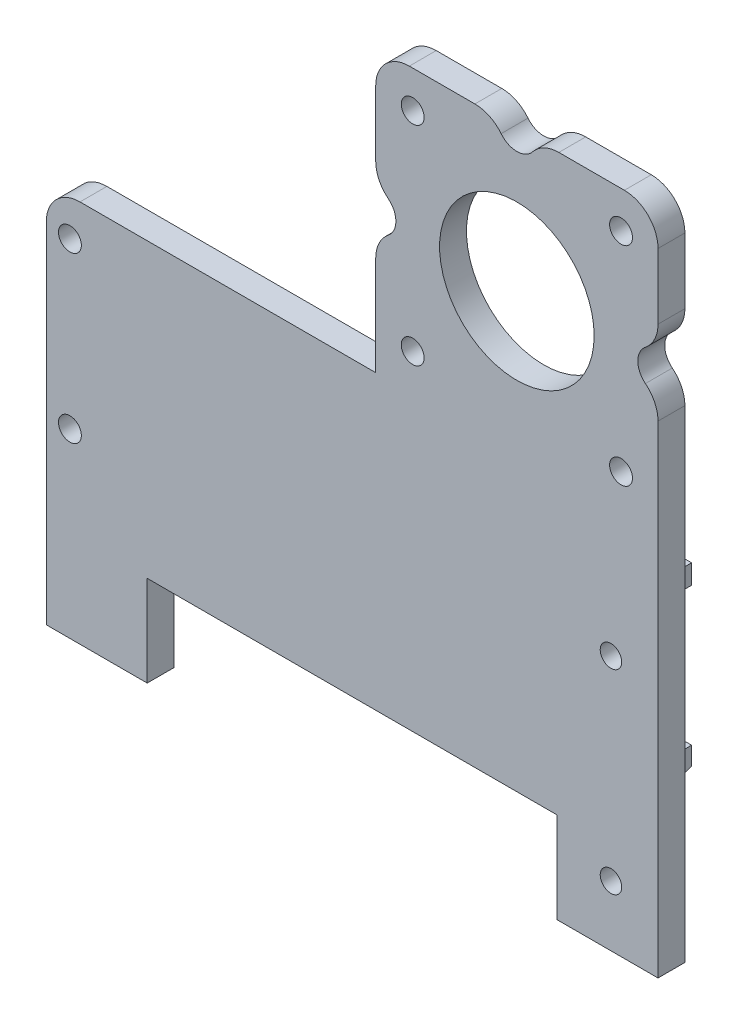
from build123d import *
from OCP.BRepFilletAPI import BRepFilletAPI_MakeChamfer

# Parameters (mm, degrees)
SKETCH_1_R          = 1.7
SKETCH_1_R_2        = 1.6
SKETCH_1_R_3        = 11.5
EXTRUDE_1_DEPTH     = 4
SKETCH_1_4_W        = 80
SKETCH_1_4_H        = 3
EXTRUDE_2_DEPTH     = 12
EXTRUDE_3_DEPTH     = 5
RIB_2_REACH         = 110.296
SKETCH_4_WALL_W     = 240.952461706
SKETCH_4_WALL_H     = 4
CUT_EXTRUDE_5_REACH = 103.686
SKETCH_5_W          = 6.95
SKETCH_5_H          = 0.1
CHAMFER_3_SIZE      = 0.8
CHAMFER_3_SIZE2     = 0.291176187
SKETCH_6_W          = 91
SKETCH_6_H          = 17
EXTRUDE_4_DEPTH     = 4
SKETCH_7_W          = 80
SKETCH_7_H          = 3.5
EXTRUDE_5_DEPTH     = 12
SKETCH_8_R          = 1.6
SKETCH_8_W          = 61
SKETCH_8_H          = 13.5
CUT_EXTRUDE_3_DEPTH = 102.133575038
CUT_EXTRUDE_4_DEPTH = 12
CHAMFER_2_SIZE      = 0.8
CHAMFER_2_SIZE2     = 0.291176187
SKETCH_10_R         = 2.2
CUT_EXTRUDE_6_DEPTH = 112.149673864
FILLET_1_R          = 5


with BuildPart() as part:
    # 草图1 → 凸台-拉伸1 (new body)
    with BuildSketch(Plane.XY):
        with BuildLine():
            Line((-70, -10), (21, -10))
            Line((21, -10), (21, 44.755002002))
            ThreePointArc((21, 44.755002002), (20.506939094, 46.920065511), (19.125, 48.658125751))
            ThreePointArc((19.125, 48.658125751), (18, 51), (19.125, 53.341874249))
            ThreePointArc((19.125, 53.341874249), (20.506939094, 55.079934489), (21, 57.244997998))
            Line((21, 57.244997998), (21, 67))
            ThreePointArc((21, 67), (19.535533906, 70.535533906), (16, 72))
            Line((16, 72), (6.244997998, 72))
            ThreePointArc((6.244997998, 72), (4.079934489, 71.506939094), (2.341874249, 70.125))
            ThreePointArc((2.341874249, 70.125), (0, 69), (-2.341874249, 70.125))
            ThreePointArc((-2.341874249, 70.125), (-4.079934489, 71.506939094), (-6.244997998, 72))
            Line((-6.244997998, 72), (-16, 72))
            ThreePointArc((-16, 72), (-19.535533906, 70.535533906), (-21, 67))
            Line((-21, 67), (-21, 57.244997998))
            ThreePointArc((-21, 57.244997998), (-20.506939094, 55.079934489), (-19.125, 53.341874249))
            ThreePointArc((-19.125, 53.341874249), (-18, 51), (-19.125, 48.658125751))
            ThreePointArc((-19.125, 48.658125751), (-20.506939094, 46.920065511), (-21, 44.755002002))
            Line((-21, 44.755002002), (-21, 30))
            Line((-21, 30), (-70, 30))
            Line((-70, 30), (-70, -10))
        make_face()
        with Locations((-66.5, 0)):
            Circle(SKETCH_1_R, mode=Mode.SUBTRACT)
        with Locations((-66.5, 24.5)):
            Circle(SKETCH_1_R, mode=Mode.SUBTRACT)
        with Locations((14, 11)):
            Circle(SKETCH_1_R_2, mode=Mode.SUBTRACT)
        with Locations((-15.5, 35.5)):
            Circle(SKETCH_1_R, mode=Mode.SUBTRACT)
        with Locations((15.5, 35.5)):
            Circle(SKETCH_1_R, mode=Mode.SUBTRACT)
        with Locations((-15.5, 66.5)):
            Circle(SKETCH_1_R, mode=Mode.SUBTRACT)
        with Locations((0, 51)):
            Circle(SKETCH_1_R_3, mode=Mode.SUBTRACT)
        with Locations((15.5, 66.5)):
            Circle(SKETCH_1_R, mode=Mode.SUBTRACT)
    extrude(amount=EXTRUDE_1_DEPTH)

    # 草图1<4> → 凸台-拉伸2 (add)
    with BuildSketch(Plane.XY):
        with Locations((-30, 11.5)):
            Rectangle(SKETCH_1_4_W, SKETCH_1_4_H)
    extrude(amount=-EXTRUDE_2_DEPTH)

    # 草图1<5> → 凸台-拉伸3 (add)
    with BuildSketch(Plane.XY):
        Polygon((3.05, 8), (3.05, 10), (-3.05, 10), (-3.05, 8), (-5.05, 8), (-5.05, 6.5), (-4.55, 6), (4.55, 6), (5.05, 6.5), (5.05, 8), align=None)
        Polygon((-16.95, 10), (-23.05, 10), (-23.05, 8), (-25.05, 8), (-25.05, 6.5), (-24.55, 6), (-15.45, 6), (-14.95, 6.5), (-14.95, 8), (-16.95, 8), align=None)
        Polygon((-36.95, 10), (-43.05, 10), (-43.05, 8), (-45.05, 8), (-45.05, 6.5), (-44.55, 6), (-35.45, 6), (-34.95, 6.5), (-34.95, 8), (-36.95, 8), align=None)
        Polygon((-26, 4.55), (-26, -4.55), (-26.5, -5.05), (-28, -5.05), (-28, -3.05), (-32, -3.05), (-32, -5.05), (-33.5, -5.05), (-34, -4.55), (-34, 4.55), (-33.5, 5.05), (-32, 5.05), (-32, 3.05), (-28, 3.05), (-28, 5.05), (-26.5, 5.05), align=None)
        Polygon((-23.05, -8), (-23.05, -10), (-16.95, -10), (-16.95, -8), (-14.95, -8), (-14.95, -6.5), (-15.45, -6), (-24.55, -6), (-25.05, -6.5), (-25.05, -8), align=None)
        Polygon((-43.05, -8), (-43.05, -10), (-36.95, -10), (-36.95, -8), (-34.95, -8), (-34.95, -6.5), (-35.45, -6), (-44.55, -6), (-45.05, -6.5), (-45.05, -8), align=None)
    extrude(amount=-EXTRUDE_3_DEPTH)

    # 草图4 wall → 筋2 (add, up to next)
    with BuildSketch(Plane(origin=(10, 23, -5), x_dir=(0, 0.894427191, 0.4472135955), z_dir=(0, -0.4472135955, 0.894427191)), mode=Mode.PRIVATE) as rib_2_sk1:
        with Locations((0, 2)):
            Rectangle(SKETCH_4_WALL_W, SKETCH_4_WALL_H)
    rib_2_tool1 = extrude(rib_2_sk1.sketch, amount=RIB_2_REACH, mode=Mode.PRIVATE) - part.part
    rib_2 = rib_2_tool1.solids().sort_by_distance((10, 23, -5))[0]
    add(rib_2)

    # 镜向1: 筋2 across plane
    add(rib_2.mirror(Plane(origin=(0, 0, 0), x_dir=(0, 0, 1), z_dir=(1, 0, 0))))

    # 切除-拉伸5: up to this face of the body (flat: up to its plane)
    cut_extrude_5_end = Plane(part.part.faces().sort_by_distance((-17.713713812, 21.851646417, 0))[0])
    # 草图5 → 切除-拉伸5 (cut, up to the picked face)
    with BuildSketch(Plane(origin=(0, 0, -12), x_dir=(-1, 0, 0), z_dir=(0, 0, -1)), mode=Mode.PRIVATE) as cut_extrude_5_sk1:
        with Locations((-6.525, 10.05)):
            Rectangle(SKETCH_5_W, SKETCH_5_H)
    cut_extrude_5_tool1 = split(extrude(cut_extrude_5_sk1.sketch, amount=-CUT_EXTRUDE_5_REACH, mode=Mode.PRIVATE), bisect_by=cut_extrude_5_end, keep=Keep.BOTH, mode=Mode.PRIVATE)
    # 草图5 → 切除-拉伸5 (cut, up to the picked face)
    with BuildSketch(Plane(origin=(0, 0, -12), x_dir=(-1, 0, 0), z_dir=(0, 0, -1)), mode=Mode.PRIVATE) as cut_extrude_5_sk2:
        Polygon((16.95, 10), (17.2, 10), (17.2, 10.1), (3.05, 10.1), (3.05, 10), align=None)
    cut_extrude_5_tool2 = split(extrude(cut_extrude_5_sk2.sketch, amount=-CUT_EXTRUDE_5_REACH, mode=Mode.PRIVATE), bisect_by=cut_extrude_5_end, keep=Keep.BOTH, mode=Mode.PRIVATE)
    # 草图5 → 切除-拉伸5 (cut, up to the picked face)
    with BuildSketch(Plane(origin=(0, 0, -12), x_dir=(-1, 0, 0), z_dir=(0, 0, -1)), mode=Mode.PRIVATE) as cut_extrude_5_sk3:
        Polygon((17.2, 7.75), (17.2, 10), (16.95, 10), (16.95, 8), (14.95, 8), (14.95, 7.75), align=None)
    cut_extrude_5_tool3 = split(extrude(cut_extrude_5_sk3.sketch, amount=-CUT_EXTRUDE_5_REACH, mode=Mode.PRIVATE), bisect_by=cut_extrude_5_end, keep=Keep.BOTH, mode=Mode.PRIVATE)
    # 草图5 → 切除-拉伸5 (cut, up to the picked face)
    with BuildSketch(Plane(origin=(0, 0, -12), x_dir=(-1, 0, 0), z_dir=(0, 0, -1)), mode=Mode.PRIVATE) as cut_extrude_5_sk4:
        Polygon((23.05, 8), (23.05, 10), (22.8, 10), (22.8, 7.75), (25.05, 7.75), (25.05, 8), align=None)
    cut_extrude_5_tool4 = split(extrude(cut_extrude_5_sk4.sketch, amount=-CUT_EXTRUDE_5_REACH, mode=Mode.PRIVATE), bisect_by=cut_extrude_5_end, keep=Keep.BOTH, mode=Mode.PRIVATE)
    # 草图5 → 切除-拉伸5 (cut, up to the picked face)
    with BuildSketch(Plane(origin=(0, 0, -12), x_dir=(-1, 0, 0), z_dir=(0, 0, -1)), mode=Mode.PRIVATE) as cut_extrude_5_sk5:
        Polygon((22.8, 10), (23.05, 10), (36.95, 10), (37.2, 10), (37.2, 10.1), (22.8, 10.1), align=None)
    cut_extrude_5_tool5 = split(extrude(cut_extrude_5_sk5.sketch, amount=-CUT_EXTRUDE_5_REACH, mode=Mode.PRIVATE), bisect_by=cut_extrude_5_end, keep=Keep.BOTH, mode=Mode.PRIVATE)
    # 草图5 → 切除-拉伸5 (cut, up to the picked face)
    with BuildSketch(Plane(origin=(0, 0, -12), x_dir=(-1, 0, 0), z_dir=(0, 0, -1)), mode=Mode.PRIVATE) as cut_extrude_5_sk6:
        Polygon((42.8, 10.1), (42.8, 10), (43.05, 10), (70, 10), (70, 10.1), align=None)
    cut_extrude_5_tool6 = split(extrude(cut_extrude_5_sk6.sketch, amount=-CUT_EXTRUDE_5_REACH, mode=Mode.PRIVATE), bisect_by=cut_extrude_5_end, keep=Keep.BOTH, mode=Mode.PRIVATE)
    # 草图5 → 切除-拉伸5 (cut, up to the picked face)
    with BuildSketch(Plane(origin=(0, 0, -12), x_dir=(-1, 0, 0), z_dir=(0, 0, -1)), mode=Mode.PRIVATE) as cut_extrude_5_sk7:
        Polygon((43.05, 10), (42.8, 10), (42.8, 7.75), (45.05, 7.75), (45.05, 8), (43.05, 8), align=None)
    cut_extrude_5_tool7 = split(extrude(cut_extrude_5_sk7.sketch, amount=-CUT_EXTRUDE_5_REACH, mode=Mode.PRIVATE), bisect_by=cut_extrude_5_end, keep=Keep.BOTH, mode=Mode.PRIVATE)
    # 草图5 → 切除-拉伸5 (cut, up to the picked face)
    with BuildSketch(Plane(origin=(0, 0, -12), x_dir=(-1, 0, 0), z_dir=(0, 0, -1)), mode=Mode.PRIVATE) as cut_extrude_5_sk8:
        Polygon((37.2, 10), (36.95, 10), (36.95, 8), (34.95, 8), (34.95, 7.75), (37.2, 7.75), align=None)
    cut_extrude_5_tool8 = split(extrude(cut_extrude_5_sk8.sketch, amount=-CUT_EXTRUDE_5_REACH, mode=Mode.PRIVATE), bisect_by=cut_extrude_5_end, keep=Keep.BOTH, mode=Mode.PRIVATE)
    add(cut_extrude_5_tool1.solids().sort_by(Axis((6.525, 10.05, -12), (0, 0, 1)))[0], mode=Mode.SUBTRACT)
    add(cut_extrude_5_tool2.solids().sort_by(Axis((-10.125, 10.05, -12), (0, 0, 1)))[0], mode=Mode.SUBTRACT)
    add(cut_extrude_5_tool3.solids().sort_by(Axis((-17.16818, 8.875, -12), (0, 0, 1)))[0], mode=Mode.SUBTRACT)
    add(cut_extrude_5_tool4.solids().sort_by(Axis((-23.01818, 9, -12), (0, 0, 1)))[0], mode=Mode.SUBTRACT)
    add(cut_extrude_5_tool5.solids().sort_by(Axis((-30, 10.05, -12), (0, 0, 1)))[0], mode=Mode.SUBTRACT)
    add(cut_extrude_5_tool6.solids().sort_by(Axis((-56.4, 10.05, -12), (0, 0, 1)))[0], mode=Mode.SUBTRACT)
    add(cut_extrude_5_tool7.solids().sort_by(Axis((-42.925, 9.96818, -12), (0, 0, 1)))[0], mode=Mode.SUBTRACT)
    add(cut_extrude_5_tool8.solids().sort_by(Axis((-37.075, 9.96818, -12), (0, 0, 1)))[0], mode=Mode.SUBTRACT)

    # 倒角3: one chamfer whose edges measure the first distance from different faces: ONE call of the kernel's chamfer builder (chamfer() names one face for all edges)
    chamfer_3_edges_1 = [part.edges().sort_by_distance(p)[0] for p in [
        (0, 6, -5),
    ]]
    chamfer_3_side_1 = [part.faces().sort_by_distance(p)[0] for p in [
        (0, 6, -2.5),
    ]]
    chamfer_3_edges_2 = [part.edges().sort_by_distance(p)[0] for p in [
        (-4.8, 6.25, -5),
    ]]
    chamfer_3_side_2 = [part.faces().sort_by_distance(p)[0] for p in [
        (-4.8, 6.25, -2.5),
    ]]
    chamfer_3_edges_3 = [part.edges().sort_by_distance(p)[0] for p in [
        (-5.05, 7.25, -5),
    ]]
    chamfer_3_side_3 = [part.faces().sort_by_distance(p)[0] for p in [
        (-5.05, 7.25, -2.5),
    ]]
    chamfer_3_edges_4 = [part.edges().sort_by_distance(p)[0] for p in [
        (-4.05, 8, -5),
    ]]
    chamfer_3_side_4 = [part.faces().sort_by_distance(p)[0] for p in [
        (-4.05, 8, -2.5),
    ]]
    chamfer_3_edges_5 = [part.edges().sort_by_distance(p)[0] for p in [
        (-3.05, 9, -5),
    ]]
    chamfer_3_side_5 = [part.faces().sort_by_distance(p)[0] for p in [
        (-3.05, 9.1125, -2.875),
    ]]
    chamfer_3_edges_6 = [part.edges().sort_by_distance(p)[0] for p in [
        (4.05, 8, -5),
    ]]
    chamfer_3_side_6 = [part.faces().sort_by_distance(p)[0] for p in [
        (4.05, 8, -2.5),
    ]]
    chamfer_3_edges_7 = [part.edges().sort_by_distance(p)[0] for p in [
        (5.05, 7.25, -5),
    ]]
    chamfer_3_side_7 = [part.faces().sort_by_distance(p)[0] for p in [
        (5.05, 7.25, -2.5),
    ]]
    chamfer_3_edges_8 = [part.edges().sort_by_distance(p)[0] for p in [
        (4.8, 6.25, -5),
    ]]
    chamfer_3_side_8 = [part.faces().sort_by_distance(p)[0] for p in [
        (4.8, 6.25, -2.5),
    ]]
    chamfer_3_edges_9 = [part.edges().sort_by_distance(p)[0] for p in [
        (3.05, 9, -5),
    ]]
    chamfer_3_side_9 = [part.faces().sort_by_distance(p)[0] for p in [
        (3.05, 9.1125, -2.875),
    ]]
    chamfer_3_edges_10 = [part.edges().sort_by_distance(p)[0] for p in [
        (-20, 6, -5),
    ]]
    chamfer_3_side_10 = [part.faces().sort_by_distance(p)[0] for p in [
        (-20, 6, -2.5),
    ]]
    chamfer_3_edges_11 = [part.edges().sort_by_distance(p)[0] for p in [
        (-24.8, 6.25, -5),
    ]]
    chamfer_3_side_11 = [part.faces().sort_by_distance(p)[0] for p in [
        (-24.8, 6.25, -2.5),
    ]]
    chamfer_3_edges_12 = [part.edges().sort_by_distance(p)[0] for p in [
        (-15.2, 6.25, -5),
    ]]
    chamfer_3_side_12 = [part.faces().sort_by_distance(p)[0] for p in [
        (-15.2, 6.25, -2.5),
    ]]
    chamfer_3_edges_13 = [part.edges().sort_by_distance(p)[0] for p in [
        (-40, 6, -5),
    ]]
    chamfer_3_side_13 = [part.faces().sort_by_distance(p)[0] for p in [
        (-40, 6, -2.5),
    ]]
    chamfer_3_edges_14 = [part.edges().sort_by_distance(p)[0] for p in [
        (-44.8, 6.25, -5),
    ]]
    chamfer_3_side_14 = [part.faces().sort_by_distance(p)[0] for p in [
        (-44.8, 6.25, -2.5),
    ]]
    chamfer_3_edges_15 = [part.edges().sort_by_distance(p)[0] for p in [
        (-35.2, 6.25, -5),
    ]]
    chamfer_3_side_15 = [part.faces().sort_by_distance(p)[0] for p in [
        (-35.2, 6.25, -2.5),
    ]]
    chamfer_3_edges_16 = [part.edges().sort_by_distance(p)[0] for p in [
        (-14.95, 7.125, -5),
    ]]
    chamfer_3_side_16 = [part.faces().sort_by_distance(p)[0] for p in [
        (-14.95, 7.125, -2.5),
    ]]
    chamfer_3_edges_17 = [part.edges().sort_by_distance(p)[0] for p in [
        (-17.2, 8.875, -5),
    ]]
    chamfer_3_side_17 = [part.faces().sort_by_distance(p)[0] for p in [
        (-17.2, 8.988253012, -2.837349398),
    ]]
    chamfer_3_edges_18 = [part.edges().sort_by_distance(p)[0] for p in [
        (-16.075, 7.75, -5),
    ]]
    chamfer_3_side_18 = [part.faces().sort_by_distance(p)[0] for p in [
        (-16.075, 7.75, -2.5),
    ]]
    chamfer_3_edges_19 = [part.edges().sort_by_distance(p)[0] for p in [
        (-45.05, 7.125, -5),
    ]]
    chamfer_3_side_19 = [part.faces().sort_by_distance(p)[0] for p in [
        (-45.05, 7.125, -2.5),
    ]]
    chamfer_3_edges_20 = [part.edges().sort_by_distance(p)[0] for p in [
        (-42.8, 8.875, -5),
    ]]
    chamfer_3_side_20 = [part.faces().sort_by_distance(p)[0] for p in [
        (-42.8, 8.988253012, -2.837349398),
    ]]
    chamfer_3_edges_21 = [part.edges().sort_by_distance(p)[0] for p in [
        (-43.925, 7.75, -5),
    ]]
    chamfer_3_side_21 = [part.faces().sort_by_distance(p)[0] for p in [
        (-43.925, 7.75, -2.5),
    ]]
    chamfer_3_edges_22 = [part.edges().sort_by_distance(p)[0] for p in [
        (-34.95, 7.125, -5),
    ]]
    chamfer_3_side_22 = [part.faces().sort_by_distance(p)[0] for p in [
        (-34.95, 7.125, -2.5),
    ]]
    chamfer_3_edges_23 = [part.edges().sort_by_distance(p)[0] for p in [
        (-25.05, 7.125, -5),
    ]]
    chamfer_3_side_23 = [part.faces().sort_by_distance(p)[0] for p in [
        (-25.05, 7.125, -2.5),
    ]]
    chamfer_3_edges_24 = [part.edges().sort_by_distance(p)[0] for p in [
        (-23.925, 7.75, -5),
    ]]
    chamfer_3_side_24 = [part.faces().sort_by_distance(p)[0] for p in [
        (-23.925, 7.75, -2.5),
    ]]
    chamfer_3_edges_25 = [part.edges().sort_by_distance(p)[0] for p in [
        (-22.8, 8.875, -5),
    ]]
    chamfer_3_side_25 = [part.faces().sort_by_distance(p)[0] for p in [
        (-22.8, 8.988253012, -2.837349398),
    ]]
    chamfer_3_edges_26 = [part.edges().sort_by_distance(p)[0] for p in [
        (-37.2, 8.875, -5),
    ]]
    chamfer_3_side_26 = [part.faces().sort_by_distance(p)[0] for p in [
        (-37.2, 8.988253012, -2.837349398),
    ]]
    chamfer_3_edges_27 = [part.edges().sort_by_distance(p)[0] for p in [
        (-36.075, 7.75, -5),
    ]]
    chamfer_3_side_27 = [part.faces().sort_by_distance(p)[0] for p in [
        (-36.075, 7.75, -2.5),
    ]]
    chamfer_3 = BRepFilletAPI_MakeChamfer(part.part.solid().wrapped)
    for e in chamfer_3_edges_1:
        chamfer_3.Add(CHAMFER_3_SIZE, CHAMFER_3_SIZE2, e.wrapped, chamfer_3_side_1[0].wrapped)  # the first distance lies on this face
    for e in chamfer_3_edges_2:
        chamfer_3.Add(CHAMFER_3_SIZE, CHAMFER_3_SIZE2, e.wrapped, chamfer_3_side_2[0].wrapped)  # the first distance lies on this face
    for e in chamfer_3_edges_3:
        chamfer_3.Add(CHAMFER_3_SIZE, CHAMFER_3_SIZE2, e.wrapped, chamfer_3_side_3[0].wrapped)  # the first distance lies on this face
    for e in chamfer_3_edges_4:
        chamfer_3.Add(CHAMFER_3_SIZE, CHAMFER_3_SIZE2, e.wrapped, chamfer_3_side_4[0].wrapped)  # the first distance lies on this face
    for e in chamfer_3_edges_5:
        chamfer_3.Add(CHAMFER_3_SIZE, CHAMFER_3_SIZE2, e.wrapped, chamfer_3_side_5[0].wrapped)  # the first distance lies on this face
    for e in chamfer_3_edges_6:
        chamfer_3.Add(CHAMFER_3_SIZE, CHAMFER_3_SIZE2, e.wrapped, chamfer_3_side_6[0].wrapped)  # the first distance lies on this face
    for e in chamfer_3_edges_7:
        chamfer_3.Add(CHAMFER_3_SIZE, CHAMFER_3_SIZE2, e.wrapped, chamfer_3_side_7[0].wrapped)  # the first distance lies on this face
    for e in chamfer_3_edges_8:
        chamfer_3.Add(CHAMFER_3_SIZE, CHAMFER_3_SIZE2, e.wrapped, chamfer_3_side_8[0].wrapped)  # the first distance lies on this face
    for e in chamfer_3_edges_9:
        chamfer_3.Add(CHAMFER_3_SIZE, CHAMFER_3_SIZE2, e.wrapped, chamfer_3_side_9[0].wrapped)  # the first distance lies on this face
    for e in chamfer_3_edges_10:
        chamfer_3.Add(CHAMFER_3_SIZE, CHAMFER_3_SIZE2, e.wrapped, chamfer_3_side_10[0].wrapped)  # the first distance lies on this face
    for e in chamfer_3_edges_11:
        chamfer_3.Add(CHAMFER_3_SIZE, CHAMFER_3_SIZE2, e.wrapped, chamfer_3_side_11[0].wrapped)  # the first distance lies on this face
    for e in chamfer_3_edges_12:
        chamfer_3.Add(CHAMFER_3_SIZE, CHAMFER_3_SIZE2, e.wrapped, chamfer_3_side_12[0].wrapped)  # the first distance lies on this face
    for e in chamfer_3_edges_13:
        chamfer_3.Add(CHAMFER_3_SIZE, CHAMFER_3_SIZE2, e.wrapped, chamfer_3_side_13[0].wrapped)  # the first distance lies on this face
    for e in chamfer_3_edges_14:
        chamfer_3.Add(CHAMFER_3_SIZE, CHAMFER_3_SIZE2, e.wrapped, chamfer_3_side_14[0].wrapped)  # the first distance lies on this face
    for e in chamfer_3_edges_15:
        chamfer_3.Add(CHAMFER_3_SIZE, CHAMFER_3_SIZE2, e.wrapped, chamfer_3_side_15[0].wrapped)  # the first distance lies on this face
    for e in chamfer_3_edges_16:
        chamfer_3.Add(CHAMFER_3_SIZE, CHAMFER_3_SIZE2, e.wrapped, chamfer_3_side_16[0].wrapped)  # the first distance lies on this face
    for e in chamfer_3_edges_17:
        chamfer_3.Add(CHAMFER_3_SIZE, CHAMFER_3_SIZE2, e.wrapped, chamfer_3_side_17[0].wrapped)  # the first distance lies on this face
    for e in chamfer_3_edges_18:
        chamfer_3.Add(CHAMFER_3_SIZE, CHAMFER_3_SIZE2, e.wrapped, chamfer_3_side_18[0].wrapped)  # the first distance lies on this face
    for e in chamfer_3_edges_19:
        chamfer_3.Add(CHAMFER_3_SIZE, CHAMFER_3_SIZE2, e.wrapped, chamfer_3_side_19[0].wrapped)  # the first distance lies on this face
    for e in chamfer_3_edges_20:
        chamfer_3.Add(CHAMFER_3_SIZE, CHAMFER_3_SIZE2, e.wrapped, chamfer_3_side_20[0].wrapped)  # the first distance lies on this face
    for e in chamfer_3_edges_21:
        chamfer_3.Add(CHAMFER_3_SIZE, CHAMFER_3_SIZE2, e.wrapped, chamfer_3_side_21[0].wrapped)  # the first distance lies on this face
    for e in chamfer_3_edges_22:
        chamfer_3.Add(CHAMFER_3_SIZE, CHAMFER_3_SIZE2, e.wrapped, chamfer_3_side_22[0].wrapped)  # the first distance lies on this face
    for e in chamfer_3_edges_23:
        chamfer_3.Add(CHAMFER_3_SIZE, CHAMFER_3_SIZE2, e.wrapped, chamfer_3_side_23[0].wrapped)  # the first distance lies on this face
    for e in chamfer_3_edges_24:
        chamfer_3.Add(CHAMFER_3_SIZE, CHAMFER_3_SIZE2, e.wrapped, chamfer_3_side_24[0].wrapped)  # the first distance lies on this face
    for e in chamfer_3_edges_25:
        chamfer_3.Add(CHAMFER_3_SIZE, CHAMFER_3_SIZE2, e.wrapped, chamfer_3_side_25[0].wrapped)  # the first distance lies on this face
    for e in chamfer_3_edges_26:
        chamfer_3.Add(CHAMFER_3_SIZE, CHAMFER_3_SIZE2, e.wrapped, chamfer_3_side_26[0].wrapped)  # the first distance lies on this face
    for e in chamfer_3_edges_27:
        chamfer_3.Add(CHAMFER_3_SIZE, CHAMFER_3_SIZE2, e.wrapped, chamfer_3_side_27[0].wrapped)  # the first distance lies on this face
    add(Compound.cast(chamfer_3.Shape()), mode=Mode.REPLACE)

    # 草图6 → 凸台-拉伸4 (add)
    with BuildSketch(Plane.XY.offset(4)):
        with Locations((-24.5, -18.5)):
            Rectangle(SKETCH_6_W, SKETCH_6_H)
    extrude(amount=-EXTRUDE_4_DEPTH)

    # 草图7 → 凸台-拉伸5 (add)
    with BuildSketch(Plane(origin=(0, 0, 0), x_dir=(-1, 0, 0), z_dir=(0, 0, -1))):
        with Locations((30, -11.75)):
            Rectangle(SKETCH_7_W, SKETCH_7_H)
    extrude(amount=EXTRUDE_5_DEPTH)

    # 草图8 → 切除-拉伸3 (cut, through all)
    with BuildSketch(Plane(origin=(0, 0, 0), x_dir=(-1, 0, 0), z_dir=(0, 0, -1))):
        with Locations((-14, -18)):
            Circle(SKETCH_8_R)
        with Locations((24.5, -20.25)):
            Rectangle(SKETCH_8_W, SKETCH_8_H)
    extrude(amount=-CUT_EXTRUDE_3_DEPTH, mode=Mode.SUBTRACT)

    # 草图9 → 切除-拉伸4 (cut)
    with BuildSketch(Plane(origin=(0, 0, -12), x_dir=(-1, 0, 0), z_dir=(0, 0, -1))):
        Polygon((70, -10), (50, -10), (25.452851286, -10), (11.122555598, -10), (-10, -10), (-10, -10.5), (70, -10.5), align=None)
        Polygon((25.452851286, -10), (50, -10), (50, 5.586221175), (25.452851286, 5.586221175), (25.452851286, 0.364824121), (11.122555598, 0.364824121), (11.122555598, -10), align=None)
    extrude(amount=-CUT_EXTRUDE_4_DEPTH, mode=Mode.SUBTRACT)

    # 倒角2
    chamfer_2_edges = [part.edges().sort_by_distance(p)[0] for p in [
        (-30, -13.5, -12),
    ]]
    chamfer_2_side = [part.faces().sort_by_distance(p)[0] for p in [
        (-28.88538206, -13.5, -4.378737542),
    ]]
    chamfer(chamfer_2_edges, length=CHAMFER_2_SIZE, length2=CHAMFER_2_SIZE2, reference=chamfer_2_side[0])

    # 草图10 → 切除-拉伸6 (cut, through all)
    with BuildSketch(Plane.XZ.offset(13.5)):
        with Locations(Location((-60, -8, 0), (0, 0, 270))):
            Circle(SKETCH_10_R)
        with Locations(Location((0, -8, 0), (0, 0, 270))):
            Circle(SKETCH_10_R)
    extrude(amount=-CUT_EXTRUDE_6_DEPTH, mode=Mode.SUBTRACT)

    # 圆角1
    fillet_1_edges = [part.edges().sort_by_distance(p)[0] for p in [
        (-70, 30, 2),
    ]]
    fillet(fillet_1_edges, radius=FILLET_1_R)


solid = part.part
